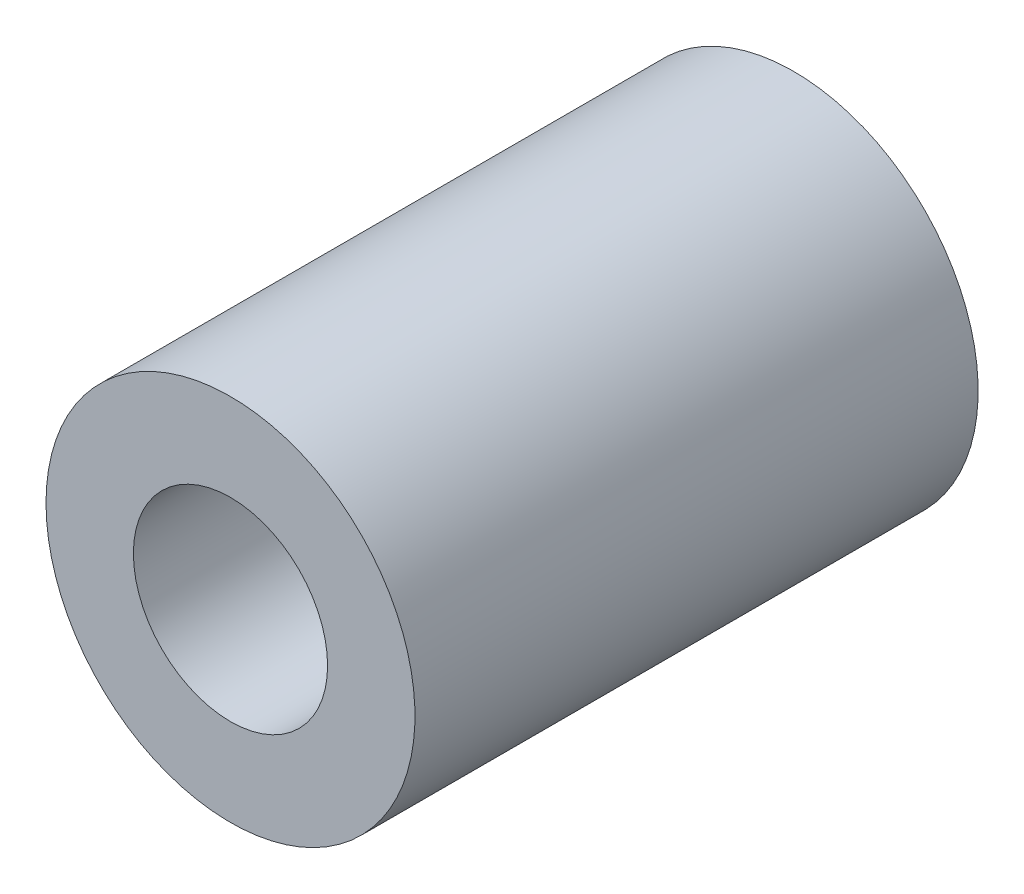
from build123d import *

# Parameters (mm, degrees)
SKETCH_1_R      = 9.5
SKETCH_1_R_2    = 5
EXTRUDE_1_DEPTH = 14.5


with BuildPart() as part:
    # 草图1 → 凸台-拉伸1 (new, symmetric)
    with BuildSketch(Plane.XY):
        with Locations(Location((0, 0, 0), (0, 0, 180))):
            Circle(SKETCH_1_R)
        with Locations(Location((0, 0, 0), (0, 0, 180))):
            Circle(SKETCH_1_R_2, mode=Mode.SUBTRACT)
    extrude(amount=EXTRUDE_1_DEPTH, both=True)


solid = part.part
